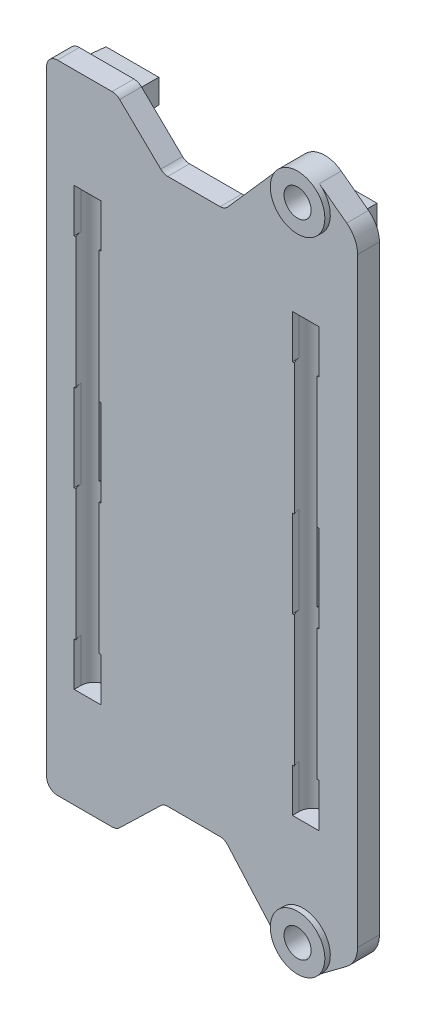
from build123d import *

# Parameters (mm, degrees)
SKETCH3_R                     = 1.5
DOWEL_BODIES_DEPTH            = 13
BOSS_EXTRUDE3_DEPTH           = 2.54
SKETCH5_W                     = 6.35
SKETCH5_H                     = 3
BOSS_EXTRUDE4_DEPTH           = 1
SKETCH12_W                    = 6.35
SKETCH12_H                    = 3
BOSS_EXTRUDE9_DEPTH           = 2
BOSS_EXTRUDE9_DRAFT           = 3
BOSS_EXTRUDE9_PROFILE_2_DEPTH = 2
BOSS_EXTRUDE9_PROFILE_2_DRAFT = 3
SKETCH6_R                     = 3.175
SKETCH6_R_2                   = 1.5
BOSS_EXTRUDE7_DEPTH           = 0.635
SKETCH11_R                    = 1.575
CUT_EXTRUDE4_DEPTH            = 3.175
SKETCH8_R                     = 1.55
CUT_EXTRUDE1_DEPTH            = 25.4
CUT_EXTRUDE2_REACH            = 196.832
SKETCH9_W                     = 1.5875
SKETCH9_H                     = 10.16
CUT_EXTRUDE3_START            = -0.788
SKETCH10_W                    = 3.1
SKETCH10_H                    = 5.08
SKETCH10_H_2                  = 10.16
CUT_EXTRUDE3_DEPTH            = 0.788
LPATTERN1_COUNT               = 2
LPATTERN1_PITCH               = 25.4


with BuildPart() as part:
    # Sketch3 → Dowel Bodies (new body)
    with BuildSketch(Plane.XY):
        with Locations(Location((184.15, 37.30625, 0), (0, 0, 180))):
            Circle(SKETCH3_R)
    extrude(amount=DOWEL_BODIES_DEPTH)


with BuildPart() as body_2:
    # Sketch4 → Boss-Extrude3 (new body)
    with BuildSketch(Plane.XY):
        with BuildLine():
            Line((168.402, 31.75), (174.498, 31.75))
            ThreePointArc((174.498, 31.75), (174.978489594, 31.853506352), (175.373745724, 32.145664541))
            Line((175.373745724, 32.145664541), (181.767401211, 39.40478473))
            ThreePointArc((181.767401211, 39.40478473), (183.824810752, 40.46455286), (186.055, 39.84625))
            Line((186.055, 39.84625), (189.23, 37.465))
            ThreePointArc((189.23, 37.465), (190.164806331, 36.344903166), (190.5, 34.925))
            Line((190.5, 34.925), (190.5, 0))
            Line((190.5, 0), (154.305, 0))
            Line((154.305, 0), (154.305, 35.79))
            ThreePointArc((154.305, 35.79), (154.676974388, 36.688025612), (155.575, 37.06))
            Line((155.575, 37.06), (161.925, 37.06))
            ThreePointArc((161.925, 37.06), (162.40113621, 36.967367534), (162.80781467, 36.702983165))
            Line((162.80781467, 36.702983165), (167.590783719, 32.078061913))
            ThreePointArc((167.590783719, 32.078061913), (167.964479579, 31.835119751), (168.402, 31.75))
        make_face()
    extrude(amount=BOSS_EXTRUDE3_DEPTH)

    # Combine1: cut part
    add(part.part, mode=Mode.SUBTRACT)

    # Sketch5 → Boss-Extrude4 (add)
    with BuildSketch(Plane(origin=(0, 0, 0), x_dir=(-1, 0, 0), z_dir=(0, 0, -1))):
        with Locations((-184.15, 34.29)):
            Rectangle(SKETCH5_W, SKETCH5_H)
        with Locations((-158.75, 34.29)):
            Rectangle(SKETCH5_W, SKETCH5_H)
    extrude(amount=BOSS_EXTRUDE4_DEPTH)


with BuildPart() as boss_extrude9_tool:
    # Sketch12 → Boss-Extrude9 (with draft: the straight prism first)
    with BuildSketch(Plane(origin=(0, 0, -1), x_dir=(-1, 0, 0), z_dir=(0, 0, -1))):
        with Locations((-158.75, 34.29)):
            Rectangle(SKETCH12_W, SKETCH12_H)
    extrude(amount=BOSS_EXTRUDE9_DEPTH)
    # Boss-Extrude9: the draft: its side faces are tilted about the plane it starts from
    boss_extrude9_sides = [boss_extrude9_tool.faces().sort_by_distance(p)[0] for p in [
        (155.575, 34.29, -2),
        (158.75, 35.79, -2),
        (161.925, 34.29, -2),
        (158.75, 32.79, -2),
    ]]
    draft(boss_extrude9_sides, Plane(origin=(0, 0, -1), x_dir=(-1, 0, 0), z_dir=(0, 0, -1)), BOSS_EXTRUDE9_DRAFT)


with BuildPart() as body_2_1:
    add(body_2.part)

    # Boss-Extrude9: add boss_extrude9_tool
    add(boss_extrude9_tool.part)


with BuildPart() as boss_extrude9_profile_2_tool:
    # Sketch12 → Boss-Extrude9 profile 2 (with draft: the straight prism first)
    with BuildSketch(Plane(origin=(0, 0, -1), x_dir=(-1, 0, 0), z_dir=(0, 0, -1))):
        with Locations((-184.15, 34.29)):
            Rectangle(SKETCH12_W, SKETCH12_H)
    extrude(amount=BOSS_EXTRUDE9_PROFILE_2_DEPTH)
    # Boss-Extrude9 profile 2: the draft: its side faces are tilted about the plane it starts from
    boss_extrude9_profile_2_sides = [boss_extrude9_profile_2_tool.faces().sort_by_distance(p)[0] for p in [
        (180.975, 34.29, -2),
        (184.15, 35.79, -2),
        (187.325, 34.29, -2),
        (184.15, 32.79, -2),
    ]]
    draft(boss_extrude9_profile_2_sides, Plane(origin=(0, 0, -1), x_dir=(-1, 0, 0), z_dir=(0, 0, -1)), BOSS_EXTRUDE9_PROFILE_2_DRAFT)


with BuildPart() as body_2_2:
    add(body_2_1.part)

    # Boss-Extrude9 profile 2: add boss_extrude9_profile_2_tool
    add(boss_extrude9_profile_2_tool.part)

    # Sketch6 → Boss-Extrude7 (add)
    with BuildSketch(Plane.XY.offset(2.54)):
        with Locations(Location((184.15, 37.30625, 0), (0, 0, 138.627190119))):
            Circle(SKETCH6_R)
        with Locations(Location((184.15, 37.30625, 0), (0, 0, 180))):
            Circle(SKETCH6_R_2, mode=Mode.SUBTRACT)
    extrude(amount=BOSS_EXTRUDE7_DEPTH)

    # Sketch11 → Cut-Extrude4 (cut)
    with BuildSketch(Plane.XY.offset(3.175)):
        with Locations((184.15, 37.30625)):
            Circle(SKETCH11_R)
    extrude(amount=-CUT_EXTRUDE4_DEPTH, mode=Mode.SUBTRACT)

    # Mirror3: body 2 across plane


with BuildPart() as body_2_3:
    add(body_2_2.part)
    add(body_2_2.part.mirror(Plane.ZX))

    # Sketch8 → Cut-Extrude1 (cut, symmetric)
    with BuildSketch(Plane(origin=(0, 0, 0), x_dir=(1, 0, 0), z_dir=(0, 1, 0))):
        with Locations((159.0675, -1.752)):
            Circle(SKETCH8_R)
    cut_extrude1 = extrude(amount=CUT_EXTRUDE1_DEPTH, both=True, mode=Mode.SUBTRACT)

    # Sketch9 → Cut-Extrude2 (cut, up to next)
    with BuildSketch(Plane.XY.offset(2.54), mode=Mode.PRIVATE) as cut_extrude2_sk1:
        with Locations((159.0675, 0)):
            Rectangle(SKETCH9_W, SKETCH9_H)
    cut_extrude2_tool1 = extrude(cut_extrude2_sk1.sketch, amount=-CUT_EXTRUDE2_REACH, mode=Mode.PRIVATE) & body_2_3.part
    cut_extrude2 = cut_extrude2_tool1.solids().sort_by_distance((159.0675, 0, 2.54))[0]
    add(cut_extrude2, mode=Mode.SUBTRACT)

    # Sketch10 → Cut-Extrude3 (cut)
    with BuildSketch(Plane.XY.offset(2.54).offset(CUT_EXTRUDE3_START)):
        with Locations((159.0675, 22.86)):
            Rectangle(SKETCH10_W, SKETCH10_H)
        with Locations((159.0675, 0)):
            Rectangle(SKETCH10_W, SKETCH10_H_2)
        with Locations((159.0675, -22.86)):
            Rectangle(SKETCH10_W, SKETCH10_H)
    cut_extrude3 = extrude(amount=CUT_EXTRUDE3_DEPTH, mode=Mode.SUBTRACT)

    # LPattern1: Cut-Extrude1, Cut-Extrude2, Cut-Extrude3 ×2
    with Locations(*[(i * LPATTERN1_PITCH, 0, 0) for i in range(1, LPATTERN1_COUNT)]):
        add(cut_extrude1, mode=Mode.SUBTRACT)
        add(cut_extrude2, mode=Mode.SUBTRACT)
        add(cut_extrude3, mode=Mode.SUBTRACT)


solid = body_2_3.part
